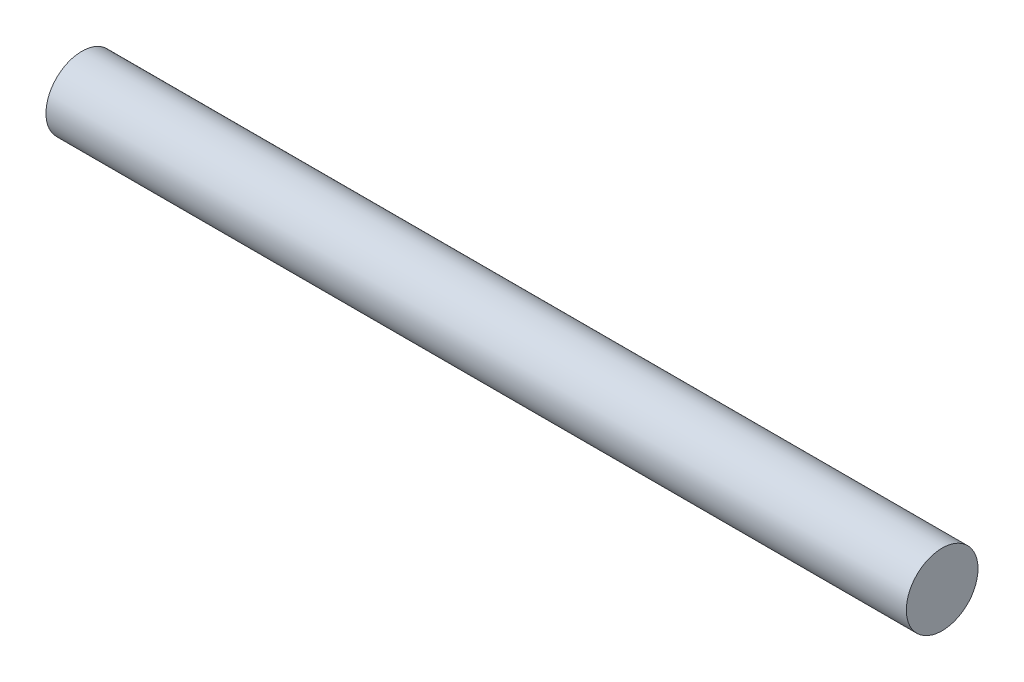
from build123d import *

# Parameters (mm, degrees)
SKETCH1_R           = 2.5
BOSS_EXTRUDE1_DEPTH = 30


with BuildPart() as part:
    # Sketch1 → Boss-Extrude1 (new, symmetric)
    with BuildSketch(Plane(origin=(0, 0, 0), x_dir=(0, 0, -1), z_dir=(1, 0, 0))):
        Circle(SKETCH1_R)
    extrude(amount=BOSS_EXTRUDE1_DEPTH, both=True)


solid = part.part
